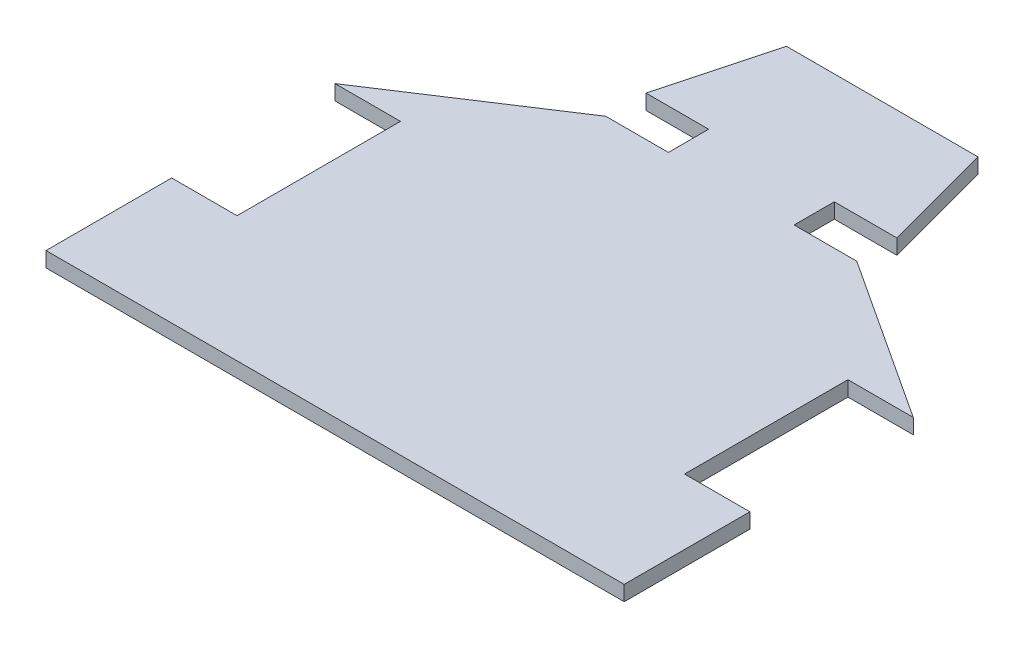
from build123d import *

# Parameters (mm, degrees)
BOSS_EXTRUDE1_DEPTH = 6


with BuildPart() as part:
    # Sketch1 → Boss-Extrude1 (new body)
    with BuildSketch(Plane(origin=(0, 0, 0), x_dir=(1, 0, 0), z_dir=(0, 1, 0))):
        Polygon((-115, 0), (115, 0), (115, 50), (89, 50), (89, 115), (115, 115), (49.928011854, 157.583462657), (25, 157.583462657), (25, 173.583462657), (49.928011854, 173.583462657), (38.1086454, 217.631526542), (-38.1086454, 217.631526542), (-49.928011854, 173.583462657), (-25, 173.583462657), (-25, 157.583462657), (-49.928011854, 157.583462657), (-115, 115), (-89, 115), (-89, 50), (-115, 50), align=None)
    extrude(amount=BOSS_EXTRUDE1_DEPTH)


solid = part.part
